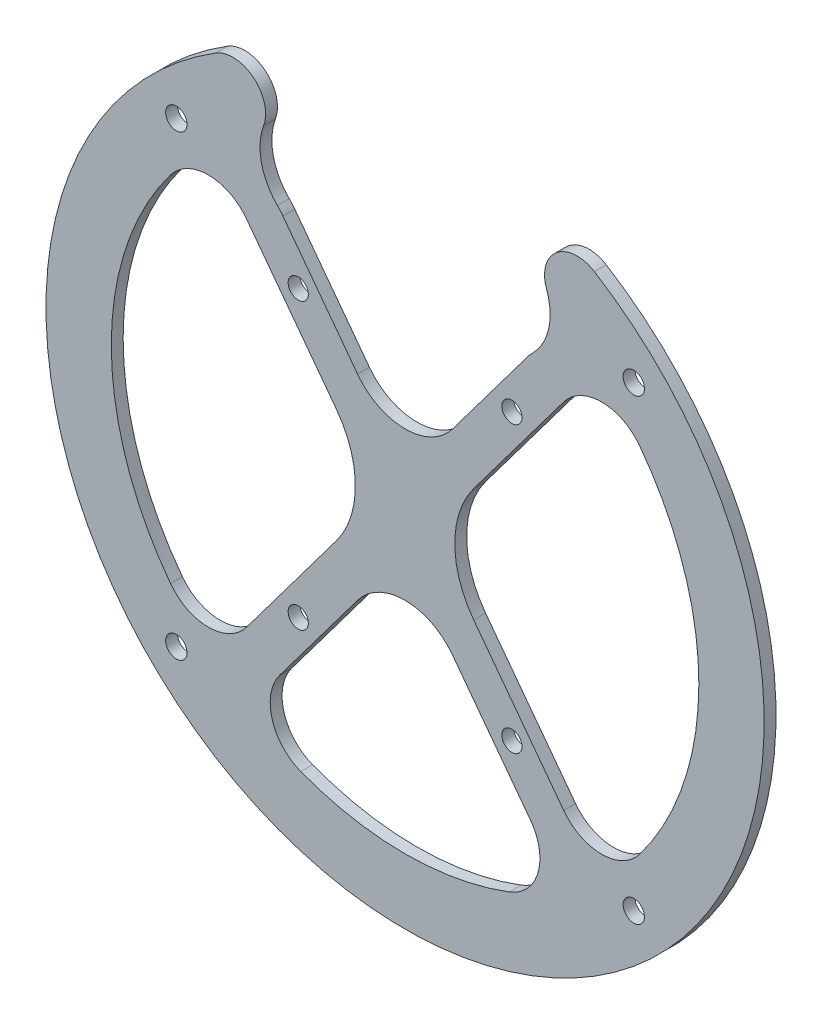
from build123d import *

# Parameters (mm, degrees)
SKETCH_1_R          = 60.5
SKETCH_1_R_2        = 1.8
EXTRUDE_1_DEPTH     = 2
SKETCH_2_R          = 1.7
CUT_EXTRUDE_1_DEPTH = 2
FILLET_2_R          = 16
FILLET_3_R          = 10
FILLET_4_R          = 8
FILLET_5_R          = 8
CUT_EXTRUDE_4_DEPTH = 10
FILLET_7_R          = 10
FILLET_8_R          = 10


with BuildPart() as part:
    # 草图1 → 凸台-拉伸1 (new body)
    with BuildSketch(Plane.XY):
        Circle(SKETCH_1_R)
        with Locations((38.537319575, 38.537319575)):
            Circle(SKETCH_1_R_2, mode=Mode.SUBTRACT)
        with Locations((38.537319575, -38.537319575)):
            Circle(SKETCH_1_R_2, mode=Mode.SUBTRACT)
        with Locations((-38.537319575, -38.537319575)):
            Circle(SKETCH_1_R_2, mode=Mode.SUBTRACT)
        with Locations((-38.537319575, 38.537319575)):
            Circle(SKETCH_1_R_2, mode=Mode.SUBTRACT)
    extrude(amount=EXTRUDE_1_DEPTH)

    # 草图2 → 切除-拉伸1 (cut)
    with BuildSketch(Plane.XY.offset(2)):
        with BuildLine():
            Line((-4.375, 0), (-22.789997499, 24.553329998))
            ThreePointArc((-22.789997499, 24.553329998), (-33.5, 0), (-22.789997499, -24.553329998))
            Line((-22.789997499, -24.553329998), (-4.375, 0))
        make_face()
        with BuildLine():
            Line((-22.789997499, 24.553329998), (-32.42566455, 37.400886066))
            ThreePointArc((-32.42566455, 37.400886066), (-49.5, 0), (-32.42566455, -37.400886066))
            Line((-32.42566455, -37.400886066), (-22.789997499, -24.553329998))
            ThreePointArc((-22.789997499, -24.553329998), (-33.5, 0), (-22.789997499, 24.553329998))
        make_face()
        with BuildLine():
            Line((17.189997499, 28.753329998), (26.82566455, 41.600886066))
            ThreePointArc((26.82566455, 41.600886066), (0, 49.5), (-26.82566455, 41.600886066))
            Line((-26.82566455, 41.600886066), (-17.189997499, 28.753329998))
            ThreePointArc((-17.189997499, 28.753329998), (0, 33.5), (17.189997499, 28.753329998))
        make_face()
        with BuildLine():
            Line((0, 5.833333333), (17.189997499, 28.753329998))
            ThreePointArc((17.189997499, 28.753329998), (0, 33.5), (-17.189997499, 28.753329998))
            Line((-17.189997499, 28.753329998), (0, 5.833333333))
        make_face()
        with BuildLine():
            ThreePointArc((49.5, 0), (45.02954805, 20.556989138), (32.42566455, 37.400886066))
            Line((32.42566455, 37.400886066), (22.789997499, 24.553329998))
            ThreePointArc((22.789997499, 24.553329998), (30.705984076, 13.393750106), (33.5, 0))
            ThreePointArc((33.5, 0), (30.705984076, -13.393750106), (22.789997499, -24.553329998))
            Line((22.789997499, -24.553329998), (32.42566455, -37.400886066))
            ThreePointArc((32.42566455, -37.400886066), (45.02954805, -20.556989138), (49.5, 0))
        make_face()
        with BuildLine():
            ThreePointArc((33.5, 0), (30.705984076, 13.393750106), (22.789997499, 24.553329998))
            Line((22.789997499, 24.553329998), (4.375, 0))
            Line((4.375, 0), (22.789997499, -24.553329998))
            ThreePointArc((22.789997499, -24.553329998), (30.705984076, -13.393750106), (33.5, 0))
        make_face()
        with BuildLine():
            ThreePointArc((-26.82566455, -41.600886066), (0, -49.5), (26.82566455, -41.600886066))
            Line((26.82566455, -41.600886066), (17.189997499, -28.753329998))
            ThreePointArc((17.189997499, -28.753329998), (0, -33.5), (-17.189997499, -28.753329998))
            Line((-17.189997499, -28.753329998), (-26.82566455, -41.600886066))
        make_face()
        with BuildLine():
            ThreePointArc((-17.189997499, -28.753329998), (0, -33.5), (17.189997499, -28.753329998))
            Line((17.189997499, -28.753329998), (0, -5.833333333))
            Line((0, -5.833333333), (-17.189997499, -28.753329998))
        make_face()
        with Locations((18, 24)):
            Circle(SKETCH_2_R)
        with Locations((-18, 24)):
            Circle(SKETCH_2_R)
        with Locations((-18, -24)):
            Circle(SKETCH_2_R)
        with Locations((18, -24)):
            Circle(SKETCH_2_R)
    extrude(amount=-CUT_EXTRUDE_1_DEPTH, mode=Mode.SUBTRACT)

    # 圆角2
    fillet_2_edges = [part.edges().sort_by_distance(p)[0] for p in [
        (4.375, 0, 1),
        (-4.375, 0, 1),
    ]]
    fillet(fillet_2_edges, radius=FILLET_2_R)

    # 圆角3
    fillet_3_edges = [part.edges().sort_by_distance(p)[0] for p in [
        (0, -5.833333333, 1),
        (0, 5.833333333, 1),
    ]]
    fillet(fillet_3_edges, radius=FILLET_3_R)

    # 圆角4
    fillet_4_edges = [part.edges().sort_by_distance(p)[0] for p in [
        (26.82566455, -41.600886066, 1),
        (-26.82566455, -41.600886066, 1),
        (-26.82566455, 41.600886066, 1),
        (26.82566455, 41.600886066, 1),
    ]]
    fillet(fillet_4_edges, radius=FILLET_4_R)

    # 圆角5
    fillet_5_edges = [part.edges().sort_by_distance(p)[0] for p in [
        (32.42566455, 37.400886066, 1),
        (32.42566455, -37.400886066, 1),
        (-32.42566455, 37.400886066, 1),
        (-32.42566455, -37.400886066, 1),
    ]]
    fillet(fillet_5_edges, radius=FILLET_5_R)

    # 草图3 → 切除-拉伸4 (cut)
    with BuildSketch(Plane.XY.offset(2)):
        with BuildLine():
            ThreePointArc((-21.124882445, 33.99984326), (-22.40824576, 41.02827952), (-17.563414, 46.279331117))
            ThreePointArc((-17.563414, 46.279331117), (-21.933404034, 44.375396195), (-26.100000126, 42.059957126))
            ThreePointArc((-26.100000126, 42.059957126), (-27.216559114, 41.346207927), (-28.313611465, 40.602825096))
            Line((-28.313611465, 40.602825096), (-21.124882445, 33.99984326))
        make_face()
        with BuildLine():
            ThreePointArc((-17.563414, 46.279331117), (-8.928132775, 48.688175619), (0, 49.5))
            Line((0, 49.5), (0, 60.5))
            ThreePointArc((0, 60.5), (-16.58538253, 58.182257487), (-31.899999898, 51.406614424))
            ThreePointArc((-31.899999898, 51.406614424), (-26.326051556, 51.539531689), (-23.5, 46.733285782))
            ThreePointArc((-23.5, 46.733285782), (-24.1937541, 44.059337326), (-26.100000126, 42.059957126))
            ThreePointArc((-26.100000126, 42.059957126), (-21.933404034, 44.375396195), (-17.563414, 46.279331117))
        make_face()
        with BuildLine():
            Line((0, 60.5), (0, 49.5))
            ThreePointArc((0, 49.5), (8.928132775, 48.688175619), (17.563414, 46.279331117))
            ThreePointArc((17.563414, 46.279331117), (21.933403961, 44.375396231), (26.099999987, 42.059957212))
            ThreePointArc((26.099999987, 42.059957212), (24.32667146, 49.633285844), (31.900000111, 51.406614291))
            ThreePointArc((31.900000111, 51.406614291), (16.585382651, 58.182257453), (0, 60.5))
        make_face()
        with BuildLine():
            ThreePointArc((26.099999987, 42.059957212), (21.933403961, 44.375396231), (17.563414, 46.279331117))
            ThreePointArc((17.563414, 46.279331117), (22.40824576, 41.02827952), (21.124882445, 33.99984326))
            Line((21.124882445, 33.99984326), (28.313611465, 40.602825096))
            ThreePointArc((28.313611465, 40.602825096), (27.216559046, 41.346207972), (26.099999987, 42.059957212))
        make_face()
    extrude(amount=-CUT_EXTRUDE_4_DEPTH, mode=Mode.SUBTRACT)

    # 圆角7
    fillet_7_edges = [part.edges().sort_by_distance(p)[0] for p in [
        (21.124882445, 33.99984326, 1),
        (-21.124882445, 33.99984326, 1),
    ]]
    fillet(fillet_7_edges, radius=FILLET_7_R)

    # 圆角8
    fillet_8_edges = [part.edges().sort_by_distance(p)[0] for p in [
        (28.313611465, 40.602825096, 1),
        (-28.313611465, 40.602825096, 1),
    ]]
    fillet(fillet_8_edges, radius=FILLET_8_R)


solid = part.part
